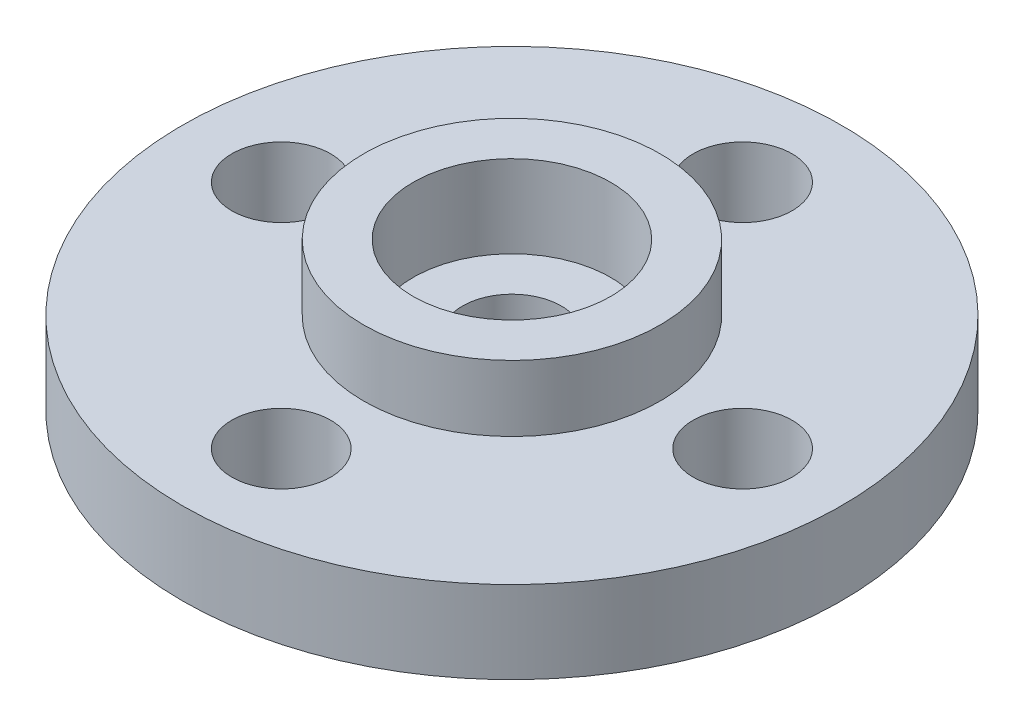
from build123d import *

# Parameters (mm, degrees)
SKETCH_1_R          = 10
SKETCH_1_R_2        = 1.5
EXTRUDE_1_DEPTH     = 2.5
SKETCH_2_R          = 4.5
SKETCH_2_R_2        = 3
EXTRUDE_2_DEPTH     = 2
CUT_EXTRUDE_START   = -0.5
SKETCH_3_R          = 3
CUT_EXTRUDE_1_DEPTH = 0.5


with BuildPart() as part:
    # 草图1 → 凸台-拉伸1 (new body)
    with BuildSketch(Plane(origin=(0, 0, 0), x_dir=(1, 0, 0), z_dir=(0, 1, 0))):
        with Locations(Location((0, 0, 0), (0, 0, 270))):
            Circle(SKETCH_1_R)
        with Locations(Location((0, 0, 0), (0, 0, 270))):
            Circle(SKETCH_1_R_2, mode=Mode.SUBTRACT)
        with Locations(Location((0, 7, 0), (0, 0, 270))):
            Circle(SKETCH_1_R_2, mode=Mode.SUBTRACT)
        with Locations(Location((7, 0, 0), (0, 0, 270))):
            Circle(SKETCH_1_R_2, mode=Mode.SUBTRACT)
        with Locations(Location((0, -7, 0), (0, 0, 270))):
            Circle(SKETCH_1_R_2, mode=Mode.SUBTRACT)
        with Locations(Location((-7, 0, 0), (0, 0, 270))):
            Circle(SKETCH_1_R_2, mode=Mode.SUBTRACT)
    extrude(amount=EXTRUDE_1_DEPTH)

    # 草图2 → 凸台-拉伸2 (add)
    with BuildSketch(Plane(origin=(0, 2.5, 0), x_dir=(1, 0, 0), z_dir=(0, 1, 0))):
        with Locations(Location((0, 0, 0), (0, 0, 270))):
            Circle(SKETCH_2_R)
        with Locations(Location((0, 0, 0), (0, 0, 270))):
            Circle(SKETCH_2_R_2, mode=Mode.SUBTRACT)
    extrude(amount=EXTRUDE_2_DEPTH)

    # 草图3 → 切除-拉伸1 (cut)
    with BuildSketch(Plane(origin=(0, 2.5, 0), x_dir=(1, 0, 0), z_dir=(0, 1, 0)).offset(CUT_EXTRUDE_START)):
        with Locations(Location((0, 0, 0), (0, 0, 270))):
            Circle(SKETCH_3_R)
    extrude(amount=CUT_EXTRUDE_1_DEPTH, mode=Mode.SUBTRACT)


solid = part.part
